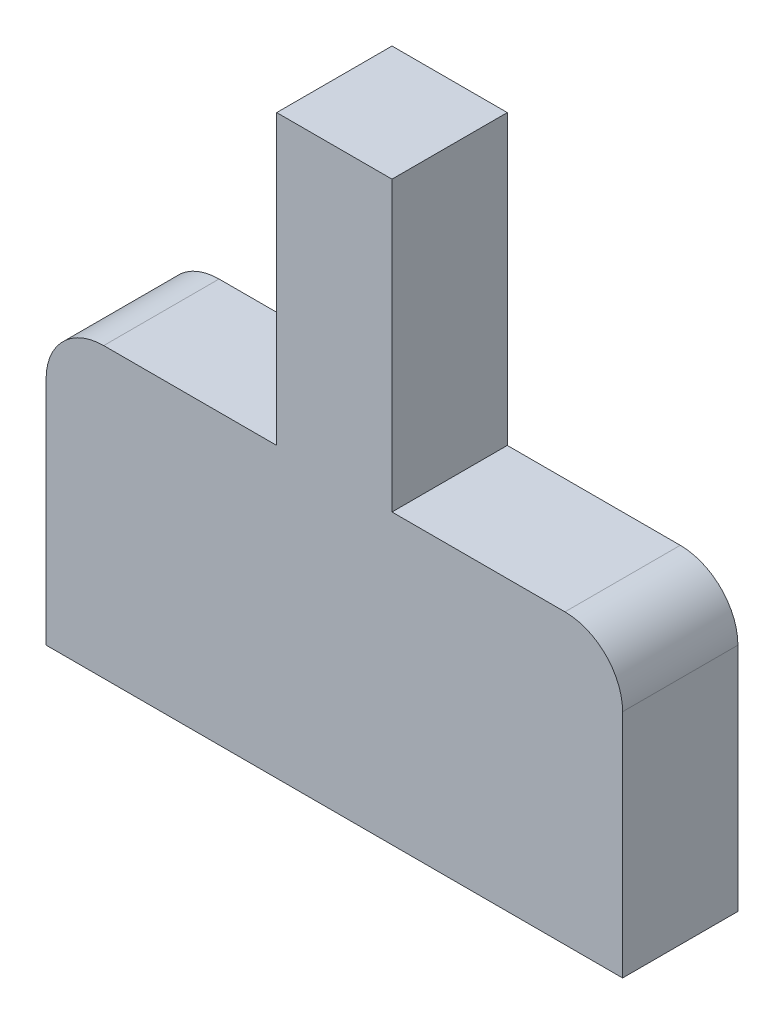
from build123d import *

# Parameters (mm, degrees)
BOSS_EXTRUDE1_DEPTH = 20


with BuildPart() as part:
    # Sketch1 → Boss-Extrude1 (new body)
    with BuildSketch(Plane.XY):
        with BuildLine():
            Line((-40, 0), (60, 0))
            Line((60, 0), (60, 40))
            ThreePointArc((60, 40), (57.071067812, 47.071067812), (50, 50))
            Line((50, 50), (20, 50))
            Line((20, 50), (20, 100))
            Line((20, 100), (0, 100))
            Line((0, 100), (0, 50))
            Line((0, 50), (-30, 50))
            ThreePointArc((-30, 50), (-37.071067812, 47.071067812), (-40, 40))
            Line((-40, 40), (-40, 0))
        make_face()
    extrude(amount=BOSS_EXTRUDE1_DEPTH)


solid = part.part
